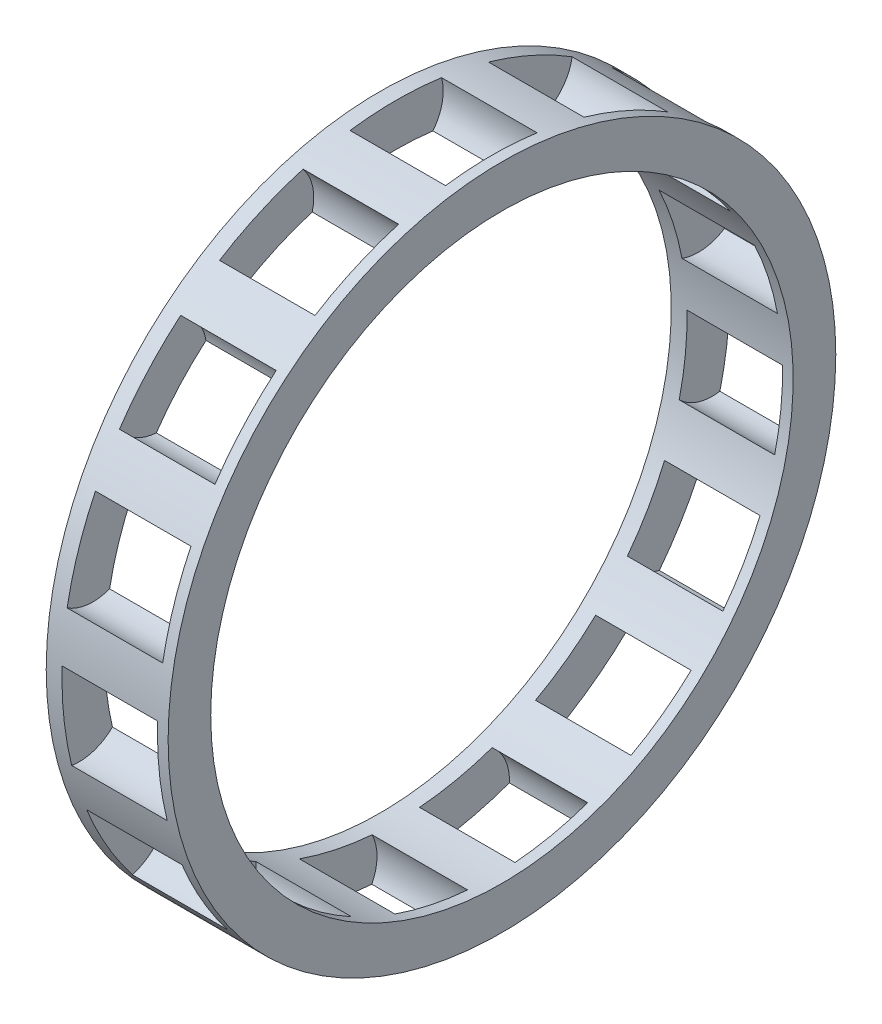
from build123d import *

# Parameters (mm, degrees)
ESQUISSE1_W                  = 9
ESQUISSE1_H                  = 3.146636507
ESQUISSE2_W                  = 7.05
ESQUISSE2_H                  = 3.5
R_P_TITION_CIRCULAIRE1_COUNT = 15


with BuildPart() as part:
    # Esquisse1 → Base-Révolution (revolve)
    with BuildSketch(Plane.XY, mode=Mode.PRIVATE) as base_r_volution_sk:
        with Locations((-1.139387669, 23.073318253)):
            Rectangle(ESQUISSE1_W, ESQUISSE1_H)
    revolve(base_r_volution_sk.sketch.rotate(Axis((-8.771095324, 0, 0), (1, 0, 0)), 90), axis=Axis((-8.771095324, 0, 0), (1, 0, 0)))

    # Esquisse2 → Enlèvement de matière-Révolution1 (revolve, cut)
    with BuildSketch(Plane.XY):
        with Locations((-0.951181968, 25.25)):
            Rectangle(ESQUISSE2_W, ESQUISSE2_H)
    enl_vement_de_mati_re_r_volution1 = revolve(axis=Axis((-7.697366985, 23.5, 0), (1, 0, 0)), mode=Mode.SUBTRACT)

    # Répétition circulaire1: Enlèvement de matière-Révolution1 ×15 about axis
    r_p_tition_circulaire1_axis = Axis((0, 0, 0), (1, 0, 0))
    for i in range(1, R_P_TITION_CIRCULAIRE1_COUNT):
        add(enl_vement_de_mati_re_r_volution1.rotate(r_p_tition_circulaire1_axis, i * 360 / R_P_TITION_CIRCULAIRE1_COUNT), mode=Mode.SUBTRACT)


solid = part.part
